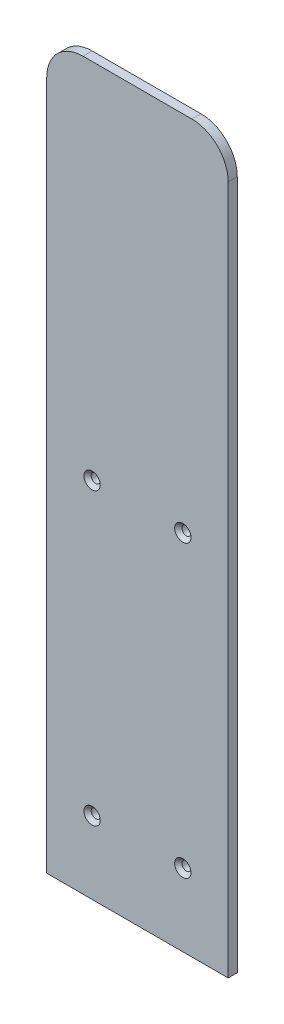
from build123d import *

# Parameters (mm, degrees)
SKETCH1_W           = 63.5
SKETCH1_H           = 254
BOSS_EXTRUDE1_DEPTH = 3.175
CUT_EXTRUDE1_REACH  = 132.947
SKETCH2_R           = 1.5875
CHAMFER1_SIZE       = 1.27
FILLET1_R           = 12.7


with BuildPart() as part:
    # Sketch1 → Boss-Extrude1 (new body)
    with BuildSketch(Plane.XY):
        Rectangle(SKETCH1_W, SKETCH1_H)
    extrude(amount=BOSS_EXTRUDE1_DEPTH)

    # Sketch2 → Cut-Extrude1 (cut, up to next)
    with BuildSketch(Plane.XY.offset(3.175), mode=Mode.PRIVATE) as cut_extrude1_sk1:
        with Locations((15.875, -101.6)):
            Circle(SKETCH2_R)
    cut_extrude1_tool1 = extrude(cut_extrude1_sk1.sketch, amount=-CUT_EXTRUDE1_REACH, mode=Mode.PRIVATE) & part.part
    # Sketch2 → Cut-Extrude1 (cut, up to next)
    with BuildSketch(Plane.XY.offset(3.175), mode=Mode.PRIVATE) as cut_extrude1_sk2:
        with Locations((-15.875, -101.6)):
            Circle(SKETCH2_R)
    cut_extrude1_tool2 = extrude(cut_extrude1_sk2.sketch, amount=-CUT_EXTRUDE1_REACH, mode=Mode.PRIVATE) & part.part
    # Sketch2 → Cut-Extrude1 (cut, up to next)
    with BuildSketch(Plane.XY.offset(3.175), mode=Mode.PRIVATE) as cut_extrude1_sk3:
        with Locations((15.875, 0)):
            Circle(SKETCH2_R)
    cut_extrude1_tool3 = extrude(cut_extrude1_sk3.sketch, amount=-CUT_EXTRUDE1_REACH, mode=Mode.PRIVATE) & part.part
    # Sketch2 → Cut-Extrude1 (cut, up to next)
    with BuildSketch(Plane.XY.offset(3.175), mode=Mode.PRIVATE) as cut_extrude1_sk4:
        with Locations((-15.875, 0)):
            Circle(SKETCH2_R)
    cut_extrude1_tool4 = extrude(cut_extrude1_sk4.sketch, amount=-CUT_EXTRUDE1_REACH, mode=Mode.PRIVATE) & part.part
    add(cut_extrude1_tool1.solids().sort_by_distance((15.875, -101.6, 3.175))[0], mode=Mode.SUBTRACT)
    add(cut_extrude1_tool2.solids().sort_by_distance((-15.875, -101.6, 3.175))[0], mode=Mode.SUBTRACT)
    add(cut_extrude1_tool3.solids().sort_by_distance((15.875, 0, 3.175))[0], mode=Mode.SUBTRACT)
    add(cut_extrude1_tool4.solids().sort_by_distance((-15.875, 0, 3.175))[0], mode=Mode.SUBTRACT)

    # Chamfer1
    chamfer1_edges = [part.edges().sort_by_distance(p)[0] for p in [
        (14.2875, -101.6, 3.175),
        (-17.4625, -101.6, 3.175),
        (14.2875, 0, 3.175),
        (-17.4625, 0, 3.175),
    ]]
    chamfer(chamfer1_edges, length=CHAMFER1_SIZE)

    # Fillet1
    fillet1_edges = [part.edges().sort_by_distance(p)[0] for p in [
        (-31.75, 127, 1.5875),
        (31.75, 127, 1.5875),
    ]]
    fillet(fillet1_edges, radius=FILLET1_R)


solid = part.part
